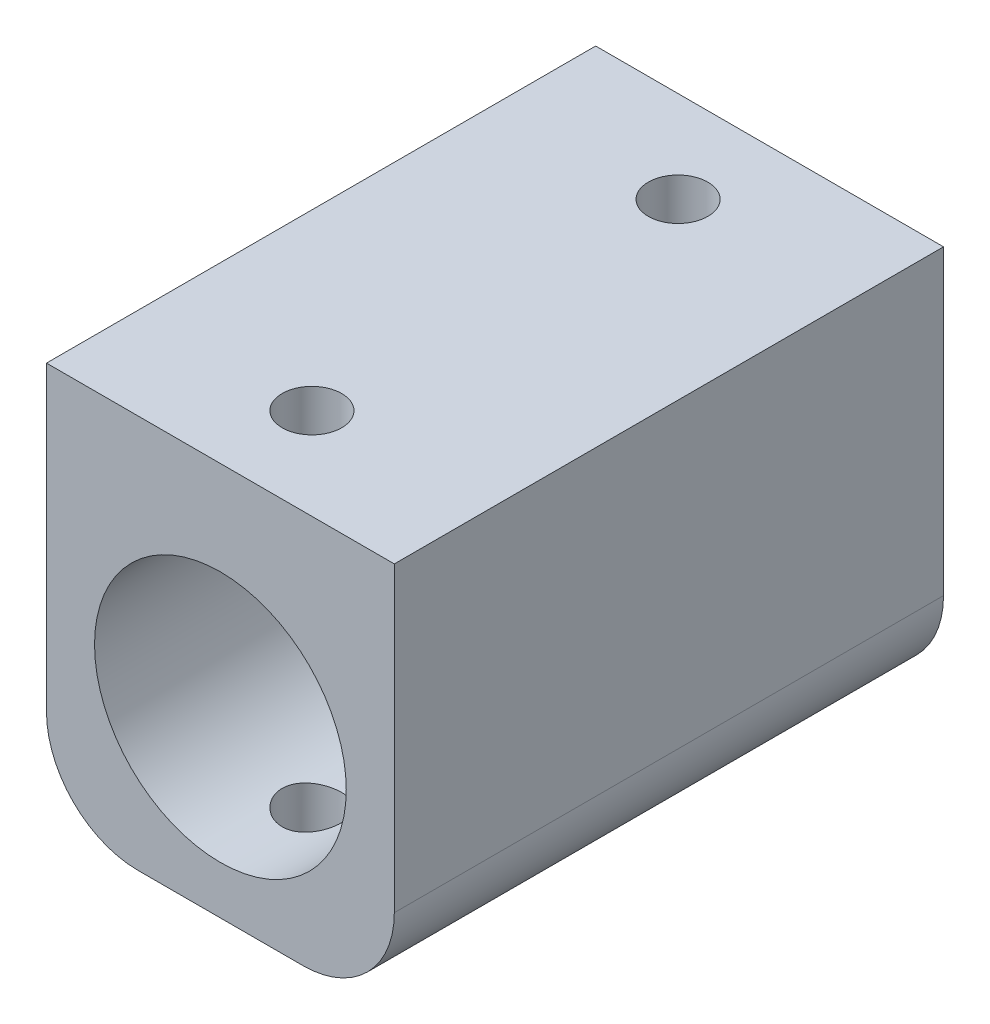
from build123d import *

# Parameters (mm, degrees)
SKETCH1_W           = 43
SKETCH1_H           = 43
SKETCH1_R           = 13.75
SKETCH1_H_2         = 7
BOSS_EXTRUDE1_DEPTH = 60
SKETCH3_R           = 3.25
CUT_EXTRUDE5_DEPTH  = 85.038324591
CHAMFER2_SIZE       = 2.5
CUT_EXTRUDE6_START  = -38
CUT_EXTRUDE6_DEPTH  = 15
SKETCH8_W           = 10
SKETCH8_H           = 51.2
CUT_EXTRUDE8_DEPTH  = 75.012431469
FILLET2_R           = 10


with BuildPart() as part:
    # Sketch1 → Boss-Extrude1 (new body)
    # profile 1 of 3: a face of its own
    with BuildSketch(Plane.XY):
        with Locations((2.5, 2.5)):
            Rectangle(SKETCH1_W, SKETCH1_H)
        Circle(SKETCH1_R, mode=Mode.SUBTRACT)
    # profile 2 of 3: a face of its own
    with BuildSketch(Plane.XY):
        with Locations((2.5, 28.7)):
            Rectangle(SKETCH1_W, SKETCH1_H_2)
    # profile 3 of 3: a face of its own
    with BuildSketch(Plane.XY):
        Polygon((24, 24), (24, -19), (29, -19), (29, 32.2), (24, 32.2), (24, 25.2), align=None)
    extrude(amount=BOSS_EXTRUDE1_DEPTH)

    # Sketch3 → Cut-Extrude5 (cut, through all)
    with BuildSketch(Plane(origin=(0, 32.2, 0), x_dir=(1, 0, 0), z_dir=(0, 1, 0))):
        with Locations(Location((0, -50, 0), (0, 0, 270))):
            Circle(SKETCH3_R)
        with Locations(Location((0, -10, 0), (0, 0, 270))):
            Circle(SKETCH3_R)
    extrude(amount=-CUT_EXTRUDE5_DEPTH, mode=Mode.SUBTRACT)

    # Chamfer2
    chamfer2_edges = [part.edges().sort_by_distance(p)[0] for p in [
        (0, 32.2, 46.75),
        (0, 32.2, 6.75),
    ]]
    chamfer(chamfer2_edges, length=CHAMFER2_SIZE)

    # Sketch7 → Cut-Extrude6 (cut)
    with BuildSketch(Plane.XZ.offset(19).offset(CUT_EXTRUDE6_START)):
        Polygon((0, 43.533676985), (5.6, 46.766838493), (5.6, 53.233161507), (0, 56.466323015), (-5.6, 53.233161507), (-5.6, 46.766838493), align=None)
        Polygon((-5.6, 13.233161507), (0, 16.466323015), (5.6, 13.233161507), (5.6, 6.766838493), (0, 3.533676985), (-5.6, 6.766838493), align=None)
    extrude(amount=CUT_EXTRUDE6_DEPTH, mode=Mode.SUBTRACT)

    # Sketch8 → Cut-Extrude8 (cut, through all)
    with BuildSketch(Plane(origin=(0, 0, 0), x_dir=(-1, 0, 0), z_dir=(0, 0, -1))):
        with Locations((-24, 6.6)):
            Rectangle(SKETCH8_W, SKETCH8_H)
    extrude(amount=-CUT_EXTRUDE8_DEPTH, mode=Mode.SUBTRACT)


with BuildPart() as body_2:
    # of the pieces the cut leaves, the one that is kept (cut_extrude8_keep)
    add(part.part.solids().sort_by_distance((-19, 24, 0))[0])

    # Fillet2
    fillet2_edges = [body_2.edges().sort_by_distance(p)[0] for p in [
        (-19, -19, 30),
        (19, -19, 30),
    ]]
    fillet(fillet2_edges, radius=FILLET2_R)


solid = body_2.part
